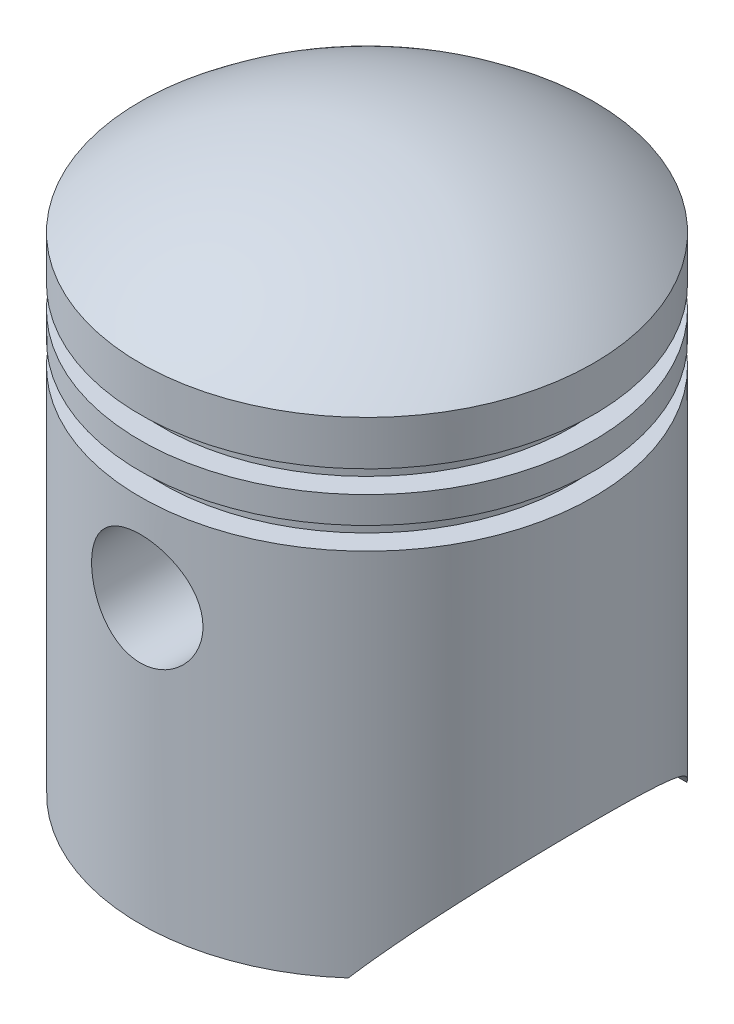
from build123d import *

# Parameters (mm, degrees)
CUT_EXTRUDE1_DEPTH       = 35
SKETCH3_R                = 6.25
CUT_EXTRUDE2_DEPTH       = 35
BOSS_EXTRUDE1_REACH      = 79.604
BOSS_EXTRUDE1_END_RADIUS = 23.432556387
SKETCH4_R                = 7.25
SKETCH4_R_2              = 6.25


with BuildPart() as part:
    # Sketch1 → Revolve1 (revolve)
    with BuildSketch(Plane.XY, mode=Mode.PRIVATE) as revolve1_sk:
        with BuildLine():
            Line((25.432556387, 0), (25.432556387, 41.5))
            Line((25.432556387, 41.5), (22.932556387, 41.5))
            Line((22.932556387, 41.5), (22.932556387, 44))
            Line((22.932556387, 44), (25.432556387, 44))
            Line((25.432556387, 44), (25.432556387, 47))
            Line((25.432556387, 47), (22.932556387, 47))
            Line((22.932556387, 47), (22.932556387, 49.5))
            Line((22.932556387, 49.5), (25.432556387, 49.5))
            Line((25.432556387, 49.5), (25.432556387, 54.5))
            ThreePointArc((25.432556387, 54.5), (13.510221664, 61.275659188), (0, 63.626304471))
            Line((0, 63.626304471), (0, 61.626304471))
            ThreePointArc((0, 61.626304471), (12.394048382, 59.548269405), (23.432556387, 53.541439456))
            Line((23.432556387, 53.541439456), (23.432556387, 51.5))
            Line((23.432556387, 51.5), (20.932556387, 51.5))
            Line((20.932556387, 51.5), (20.932556387, 45.5))
            Line((20.932556387, 45.5), (20.932556387, 39.5))
            Line((20.932556387, 39.5), (23.432556387, 39.5))
            Line((23.432556387, 39.5), (23.432556387, 0))
            Line((23.432556387, 0), (25.432556387, 0))
        make_face()
    revolve(revolve1_sk.sketch.rotate(Axis((0, 0, 0), (0, 1, 0)), 90), axis=Axis((0, 0, 0), (0, 1, 0)))

    # Sketch2 → Cut-Extrude1 (cut, symmetric)
    with BuildSketch(Plane(origin=(0, 0, 0), x_dir=(0, 0, -1), z_dir=(1, 0, 0))):
        with BuildLine():
            Line((-19, 0), (19, 0))
            ThreePointArc((19, 0), (0, 10), (-19, 0))
        make_face()
    extrude(amount=CUT_EXTRUDE1_DEPTH, both=True, mode=Mode.SUBTRACT)

    # Sketch3 → Cut-Extrude2 (cut, symmetric)
    with BuildSketch(Plane.XY):
        with Locations((0, 31.626304471)):
            Circle(SKETCH3_R)
    extrude(amount=CUT_EXTRUDE2_DEPTH, both=True, mode=Mode.SUBTRACT)

    # Boss-Extrude1: up to this cylinder (the profile starts inside it)
    boss_extrude1_end = Plane(origin=(0, 31.626304, 0), z_dir=(0, -1, 0)) * Cylinder(BOSS_EXTRUDE1_END_RADIUS, 207.073112775, mode=Mode.PRIVATE)
    # Sketch4 → Boss-Extrude1 (add, up to the surface)
    with BuildSketch(Plane.XY.offset(11), mode=Mode.PRIVATE) as boss_extrude1_sk1:
        with Locations(Location((0, 31.626304471, 0), (0, 0, 180))):
            Circle(SKETCH4_R)
        with Locations((0, 31.626304471)):
            Circle(SKETCH4_R_2, mode=Mode.SUBTRACT)
    boss_extrude1_tool1 = extrude(boss_extrude1_sk1.sketch, amount=BOSS_EXTRUDE1_REACH, mode=Mode.PRIVATE) & boss_extrude1_end
    boss_extrude1 = boss_extrude1_tool1.solids().sort_by_distance((7.044939, 31.626304, 11))[0]
    add(boss_extrude1)

    # Mirror1: Boss-Extrude1 across plane
    add(boss_extrude1.mirror(Plane.XY))


solid = part.part
